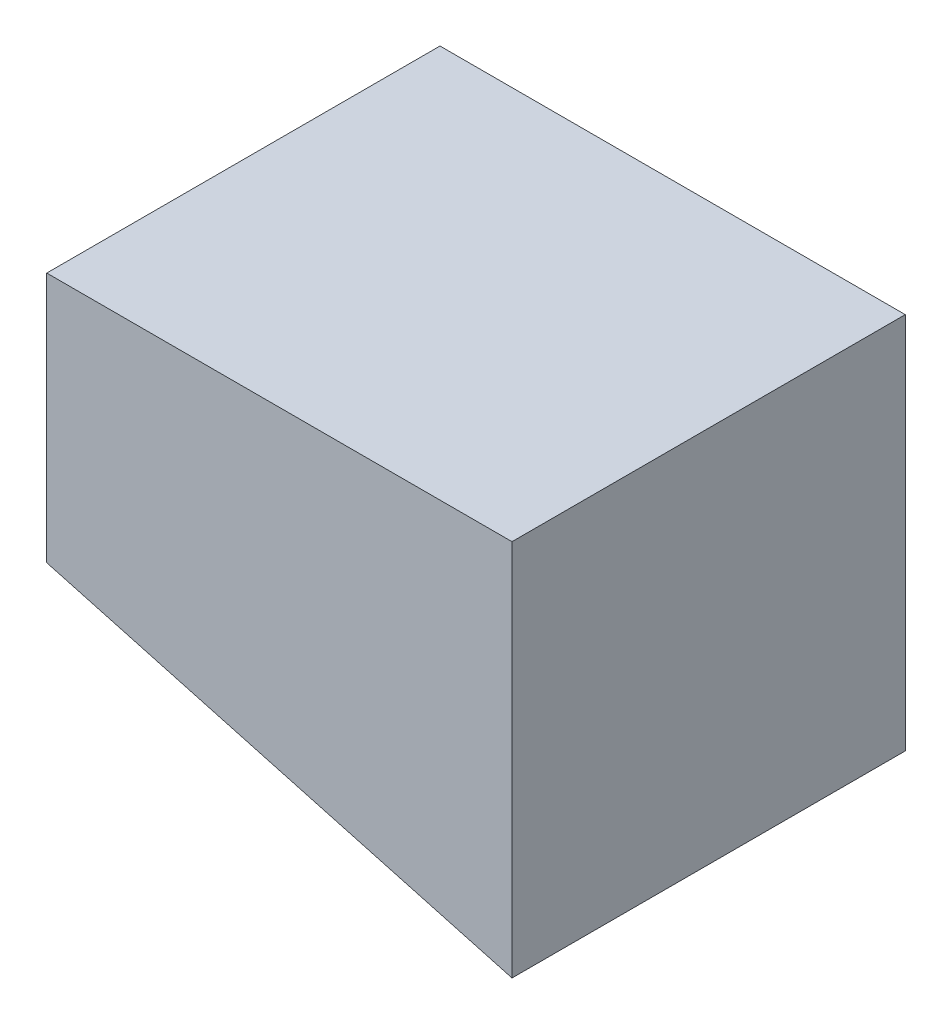
from build123d import *

# Parameters (mm, degrees)
SKETCH1_W           = 492.5
SKETCH1_H           = 416.27
BOSS_EXTRUDE1_DEPTH = 400
CUT_EXTRUDE2_DEPTH  = 628.630285598


with BuildPart() as part:
    # Sketch1 → Boss-Extrude1 (new body)
    with BuildSketch(Plane(origin=(0, 0, 0), x_dir=(1, 0, 0), z_dir=(0, 1, 0))):
        Rectangle(SKETCH1_W, SKETCH1_H)
    extrude(amount=BOSS_EXTRUDE1_DEPTH)

    # Sketch3 → Cut-Extrude2 (cut, through all)
    with BuildSketch(Plane.XY.offset(208.135)):
        Polygon((246.25, 0), (-246.25, 134.439189184), (-246.25, 0), align=None)
    extrude(amount=-CUT_EXTRUDE2_DEPTH, mode=Mode.SUBTRACT)


solid = part.part
